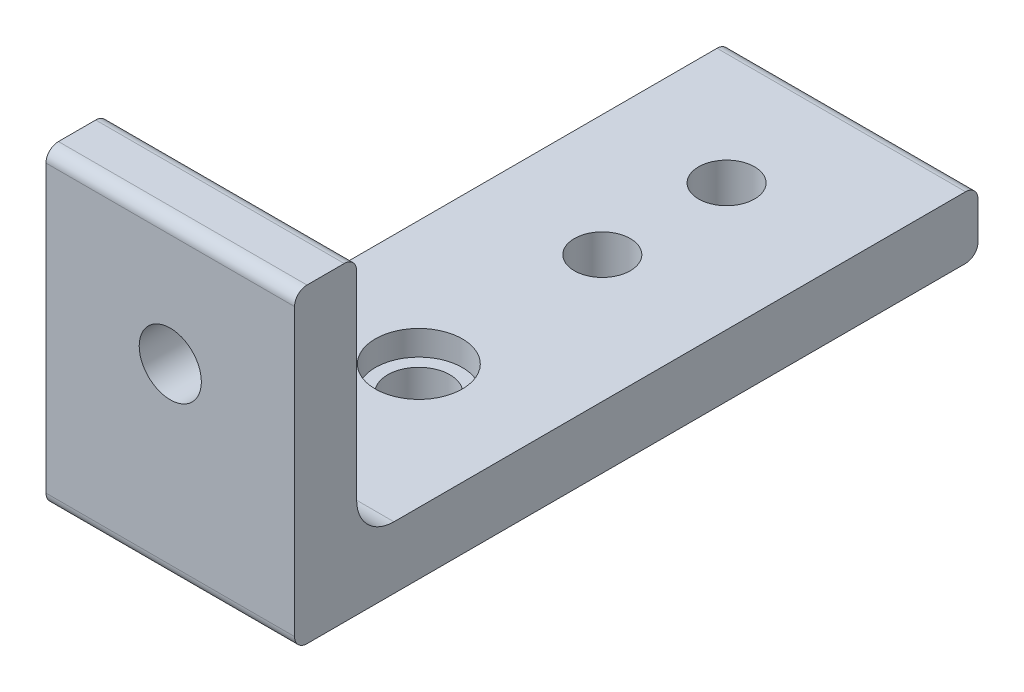
from build123d import *

# Parameters (mm, degrees)
EXTRUDE_1_DEPTH     = 20
FILLET_1_R          = 3
FILLET_2_R          = 1
SKETCH_2_R          = 2.5
CUT_EXTRUDE_1_DEPTH = 20
SKETCH_3_R          = 2.25
SKETCH_3_R_2        = 2.5
CUT_EXTRUDE_2_DEPTH = 20
SKETCH_5_R          = 3.5
CUT_EXTRUDE_3_DEPTH = 2


with BuildPart() as part:
    # 草图1 → 凸台-拉伸1 (new body)
    with BuildSketch(Plane(origin=(0, 0, 0), x_dir=(0, 0, -1), z_dir=(1, 0, 0))):
        Polygon((0, 0), (55, 0), (55, 5), (5, 5), (5, 25), (0, 25), align=None)
    extrude(amount=EXTRUDE_1_DEPTH)

    # 圆角1
    fillet_1_edges = [part.edges().sort_by_distance(p)[0] for p in [
        (10, 5, -5),
    ]]
    fillet(fillet_1_edges, radius=FILLET_1_R)

    # 圆角2
    fillet_2_edges = [part.edges().sort_by_distance(p)[0] for p in [
        (10, 25, 0),
        (10, 25, -5),
        (10, 5, -55),
        (10, 0, -55),
        (10, 0, 0),
    ]]
    fillet(fillet_2_edges, radius=FILLET_2_R)

    # 草图2 → 切除-拉伸1 (cut)
    with BuildSketch(Plane(origin=(0, 0, -5), x_dir=(-1, 0, 0), z_dir=(0, 0, -1))):
        with Locations(Location((-10, 15, 0), (0, 0, 90))):
            Circle(SKETCH_2_R)
    extrude(amount=-CUT_EXTRUDE_1_DEPTH, mode=Mode.SUBTRACT)

    # 草图3 → 切除-拉伸2 (cut)
    with BuildSketch(Plane(origin=(0, 5, 0), x_dir=(1, 0, 0), z_dir=(0, 1, 0))):
        with Locations(Location((9.767852346, 45, 0), (0, 0, 270))):
            Circle(SKETCH_3_R)
        with Locations(Location((9.767852346, 35, 0), (0, 0, 270))):
            Circle(SKETCH_3_R)
        with Locations(Location((10, 20.001796525, 0), (0, 0, 270))):
            Circle(SKETCH_3_R_2)
    extrude(amount=-CUT_EXTRUDE_2_DEPTH, mode=Mode.SUBTRACT)

    # 草图5 → 切除-拉伸3 (cut)
    with BuildSketch(Plane(origin=(0, 5, 0), x_dir=(1, 0, 0), z_dir=(0, 1, 0))):
        with Locations(Location((10, 20.001796525, 0), (0, 0, 270))):
            Circle(SKETCH_5_R)
    extrude(amount=-CUT_EXTRUDE_3_DEPTH, mode=Mode.SUBTRACT)


solid = part.part
